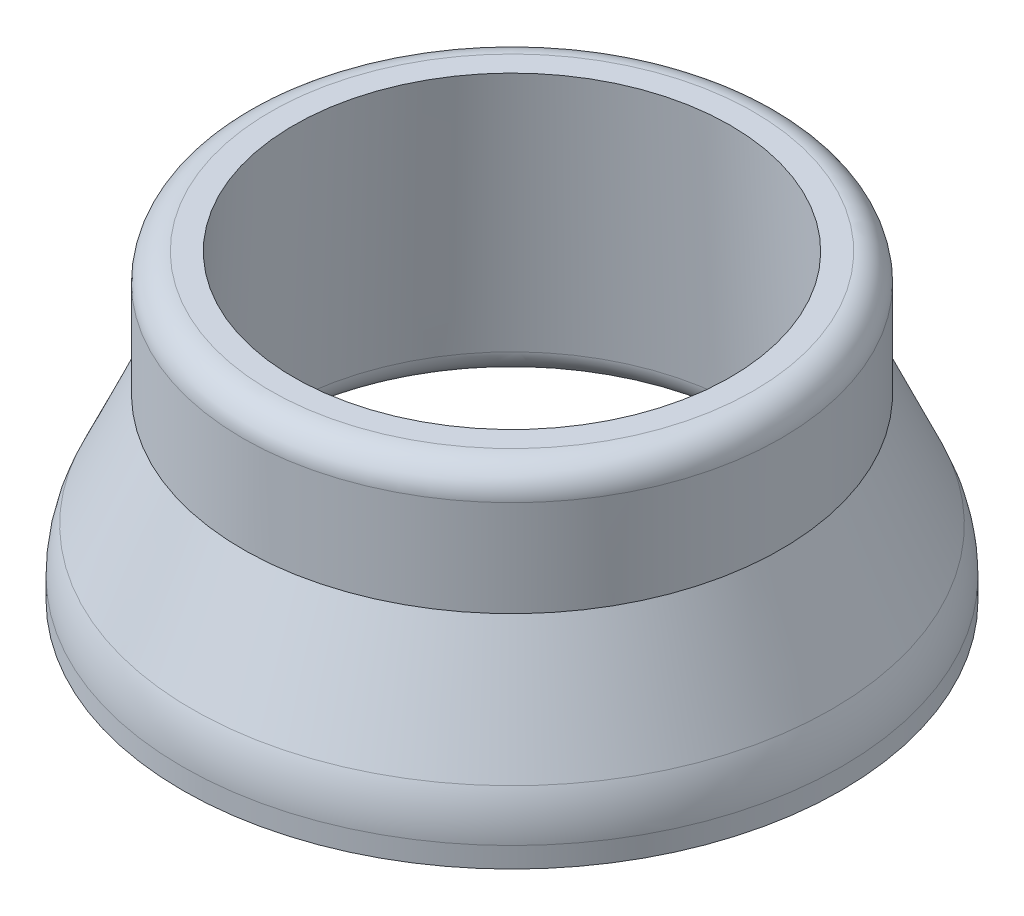
from build123d import *

# Parameters (mm, degrees)
FILLET1_R = 1
FILLET2_R = 1
FILLET3_R = 4


with BuildPart() as part:
    # Sketch2 → Revolve1 (revolve)
    with BuildSketch(Plane.XY, mode=Mode.PRIVATE) as revolve1_sk:
        Polygon((0, 0), (12, 0), (12, 1.6), (9.8, 6.5), (9.8, 11), (0, 11), align=None)
    revolve(revolve1_sk.sketch.rotate(Axis((0, 11, 0), (0, -1, 0)), 180), axis=Axis((0, 11, 0), (0, -1, 0)))

    # Sketch4 → Cut-Revolve1 (revolve, cut)
    with BuildSketch(Plane.XY, mode=Mode.PRIVATE) as cut_revolve1_sk:
        Polygon((0, 0), (0, 11), (7.95, 11), (8.45, 1.2), (12, 0), align=None)
    revolve(cut_revolve1_sk.sketch.rotate(Axis((0, 0, 0), (0, 1, 0)), 90), axis=Axis((0, 0, 0), (0, 1, 0)), mode=Mode.SUBTRACT)

    # Fillet1
    fillet1_edges = [part.edges().sort_by_distance(p)[0] for p in [
        (9.8, 11, 0),
    ]]
    fillet(fillet1_edges, radius=FILLET1_R)

    # Fillet2
    fillet2_edges = [part.edges().sort_by_distance(p)[0] for p in [
        (0, 1.2, 8.45),
    ]]
    fillet(fillet2_edges, radius=FILLET2_R)

    # Fillet3
    fillet3_edges = [part.edges().sort_by_distance(p)[0] for p in [
        (12, 1.6, 0),
    ]]
    fillet(fillet3_edges, radius=FILLET3_R)


solid = part.part
